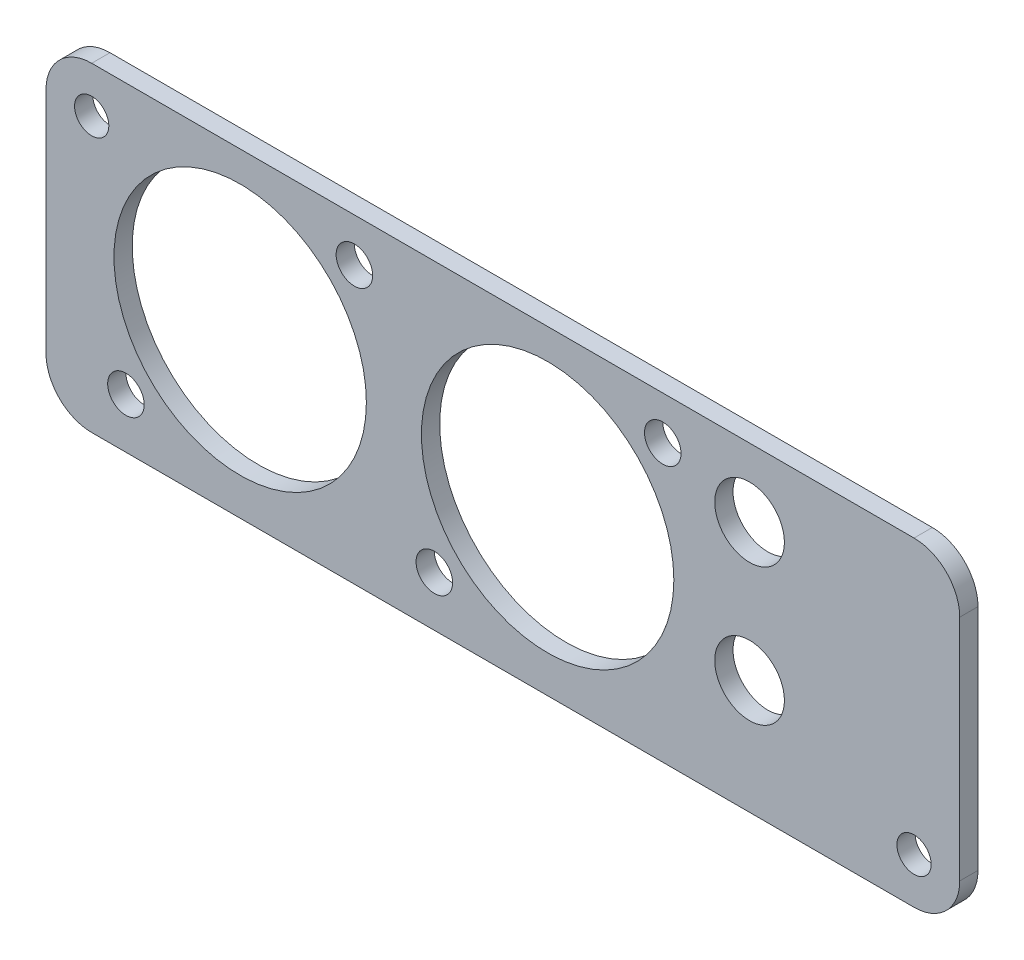
from build123d import *

# Parameters (mm, degrees)
SKETCH1_R           = 11.05
SKETCH1_R_2         = 1.6
SKETCH1_R_3         = 1.5
SKETCH1_R_4         = 3.05
BOSS_EXTRUDE1_DEPTH = 1.6


with BuildPart() as part:
    # Sketch1 → Boss-Extrude1 (new body)
    with BuildSketch(Plane.XY):
        with BuildLine():
            Line((-36, -14), (36, -14))
            ThreePointArc((36, -14), (38.828427125, -12.828427125), (40, -10))
            Line((40, -10), (40, 10))
            ThreePointArc((40, 10), (38.828427125, 12.828427125), (36, 14))
            Line((36, 14), (-36, 14))
            ThreePointArc((-36, 14), (-38.828427125, 12.828427125), (-40, 10))
            Line((-40, 10), (-40, -10))
            ThreePointArc((-40, -10), (-38.828427125, -12.828427125), (-36, -14))
        make_face()
        with Locations((-23, 0.3)):
            Circle(SKETCH1_R, mode=Mode.SUBTRACT)
        with Locations((3.92, 0.3)):
            Circle(SKETCH1_R, mode=Mode.SUBTRACT)
        with Locations((14, 10.2)):
            Circle(SKETCH1_R_2, mode=Mode.SUBTRACT)
        with Locations((-6, -9.6)):
            Circle(SKETCH1_R_2, mode=Mode.SUBTRACT)
        with Locations((-33, -9.6)):
            Circle(SKETCH1_R_2, mode=Mode.SUBTRACT)
        with Locations((-13, 10.2)):
            Circle(SKETCH1_R_2, mode=Mode.SUBTRACT)
        with Locations((-36, 10)):
            Circle(SKETCH1_R_3, mode=Mode.SUBTRACT)
        with Locations((21.6, 8)):
            Circle(SKETCH1_R_4, mode=Mode.SUBTRACT)
        with Locations((21.6, -4)):
            Circle(SKETCH1_R_4, mode=Mode.SUBTRACT)
        with Locations((36, -10)):
            Circle(SKETCH1_R_3, mode=Mode.SUBTRACT)
    extrude(amount=BOSS_EXTRUDE1_DEPTH)


solid = part.part
